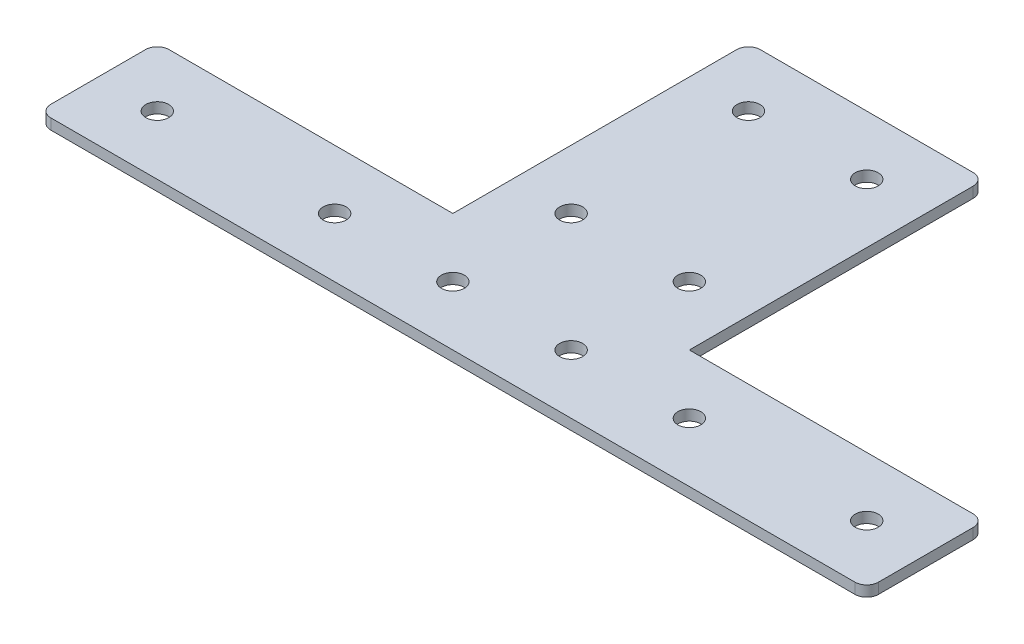
from build123d import *

# Parameters (mm, degrees)
BOSS_EXTRUDE1_DEPTH = 2.286
SKETCH3_R           = 2.4638
CUT_EXTRUDE2_DEPTH  = 126.744366856
FILLET1_R           = 2.54


with BuildPart() as part:
    # Sketch1 → Boss-Extrude1 (new body)
    with BuildSketch(Plane(origin=(0, 0, 0), x_dir=(1, 0, 0), z_dir=(0, 1, 0))):
        Polygon((0, 0), (88.9, 0), (88.9, 25.4), (25.4, 25.4), (25.4, 88.9), (0, 88.9), align=None)
    boss_extrude1 = extrude(amount=BOSS_EXTRUDE1_DEPTH)

    # Sketch3 → Cut-Extrude2 (cut, through all)
    with BuildSketch(Plane(origin=(0, 2.286, 0), x_dir=(1, 0, 0), z_dir=(0, 1, 0))):
        with Locations(Location((76.2, 12.7, 0), (0, 0, 270))):
            Circle(SKETCH3_R)
        with Locations(Location((12.7, 12.7, 0), (0, 0, 270))):
            Circle(SKETCH3_R)
        with Locations(Location((12.7, 76.2, 0), (0, 0, 270))):
            Circle(SKETCH3_R)
        with Locations(Location((12.7, 38.1, 0), (0, 0, 270))):
            Circle(SKETCH3_R)
        with Locations(Location((38.1, 12.7, 0), (0, 0, 270))):
            Circle(SKETCH3_R)
    cut_extrude2 = extrude(amount=-CUT_EXTRUDE2_DEPTH, mode=Mode.SUBTRACT)

    # Mirror1: Boss-Extrude1, Cut-Extrude2 across plane
    add(boss_extrude1.mirror(Plane(origin=(0, 2.286, -88.9), x_dir=(0, 0, 1), z_dir=(1, 0, 0))))
    add(cut_extrude2.mirror(Plane(origin=(0, 2.286, -88.9), x_dir=(0, 0, 1), z_dir=(1, 0, 0))), mode=Mode.SUBTRACT)

    # Fillet1
    fillet1_edges = [part.edges().sort_by_distance(p)[0] for p in [
        (25.4, 1.143, -88.9),
        (88.9, 1.143, -25.4),
        (88.9, 1.143, 0),
        (-25.4, 1.143, -88.9),
        (-88.9, 1.143, -25.4),
        (-88.9, 1.143, 0),
    ]]
    fillet(fillet1_edges, radius=FILLET1_R)


solid = part.part
